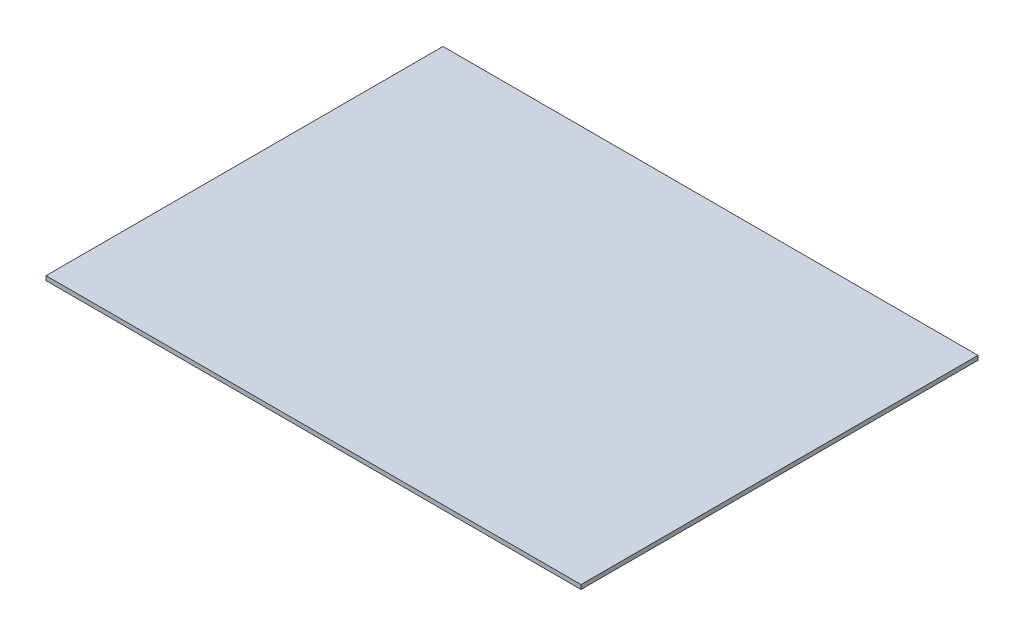
from build123d import *

# Parameters (mm, degrees)
SKETCH1_W           = 393.7
SKETCH1_H           = 292.1
BOSS_EXTRUDE1_DEPTH = 3.175


with BuildPart() as part:
    # Sketch1 → Boss-Extrude1 (new body)
    with BuildSketch(Plane(origin=(0, 0, 0), x_dir=(1, 0, 0), z_dir=(0, 1, 0))):
        with Locations((196.85, 146.05)):
            Rectangle(SKETCH1_W, SKETCH1_H)
    extrude(amount=BOSS_EXTRUDE1_DEPTH)


solid = part.part
